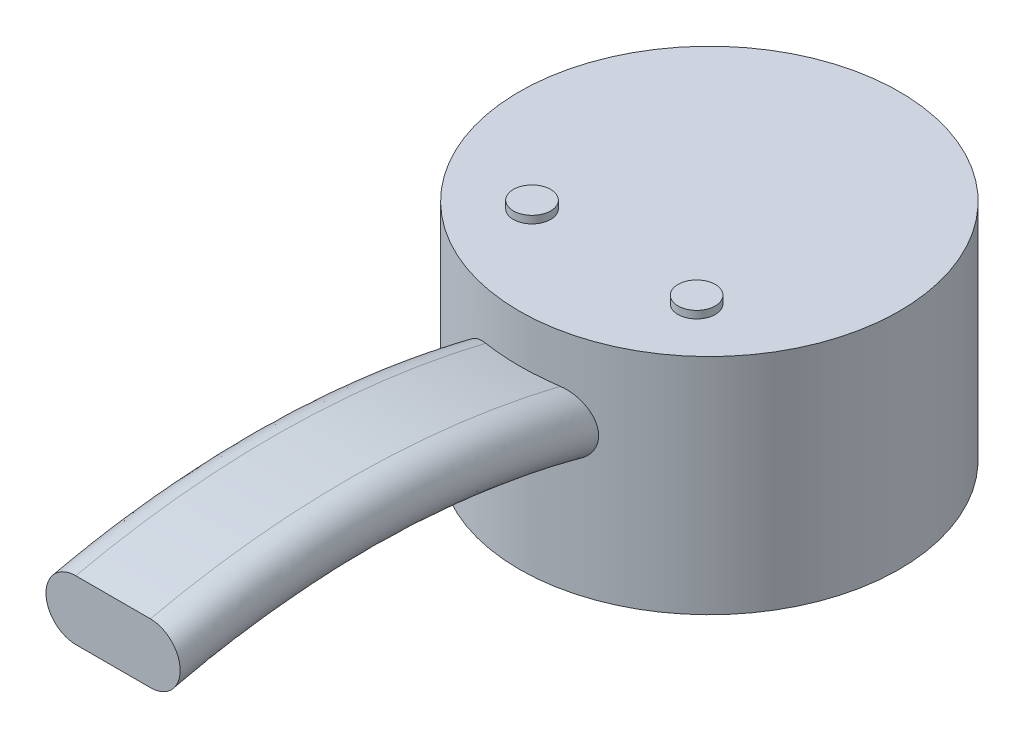
from build123d import *

# Parameters (mm, degrees)
SKETCH1_R           = 25.5
BOSS_EXTRUDE1_DEPTH = 30
SHELL1_T            = -10
SKETCH6_R           = 2.5
BOSS_EXTRUDE2_DEPTH = 1


with BuildPart() as part:
    # Sketch1 → Boss-Extrude1 (new body)
    with BuildSketch(Plane(origin=(0, 0, 0), x_dir=(1, 0, 0), z_dir=(0, 1, 0))):
        with Locations(Location((0, 0, 0), (0, 0, 270))):
            Circle(SKETCH1_R)
    extrude(amount=BOSS_EXTRUDE1_DEPTH)

    # Shell1
    shell1_openings = [part.faces().sort_by_distance(p)[0] for p in [
        (0, 0, 0),
    ]]
    offset(amount=SHELL1_T, openings=shell1_openings, kind=Kind.INTERSECTION)

    # Sweep1: sweep along a path in Sketch5
    with BuildLine(Plane(origin=(0, 0, 0), x_dir=(0, 0, -1), z_dir=(1, 0, 0))) as sweep1_path:
        ThreePointArc((0, 10), (-39.105669761, 22.154641912), (-80, 20))
    # Sketch4 → Sweep1 (sweep)
    with BuildSketch(Plane.XY.offset(80)):
        with BuildLine():
            Line((5, 16), (-5, 16))
            ThreePointArc((-5, 16), (-9, 20), (-5, 24))
            Line((-5, 24), (5, 24))
            ThreePointArc((5, 24), (9, 20), (5, 16))
        make_face()
    sweep(path=sweep1_path.line)

    # Sketch6 → Boss-Extrude2 (add)
    with BuildSketch(Plane(origin=(0, 30, 0), x_dir=(1, 0, 0), z_dir=(0, 1, 0))):
        with Locations(Location((-11.041823898, -12.75, 0), (0, 0, 270))):
            Circle(SKETCH6_R)
        with Locations(Location((11.041823898, -12.75, 0), (0, 0, 90))):
            Circle(SKETCH6_R)
    extrude(amount=BOSS_EXTRUDE2_DEPTH)


solid = part.part
